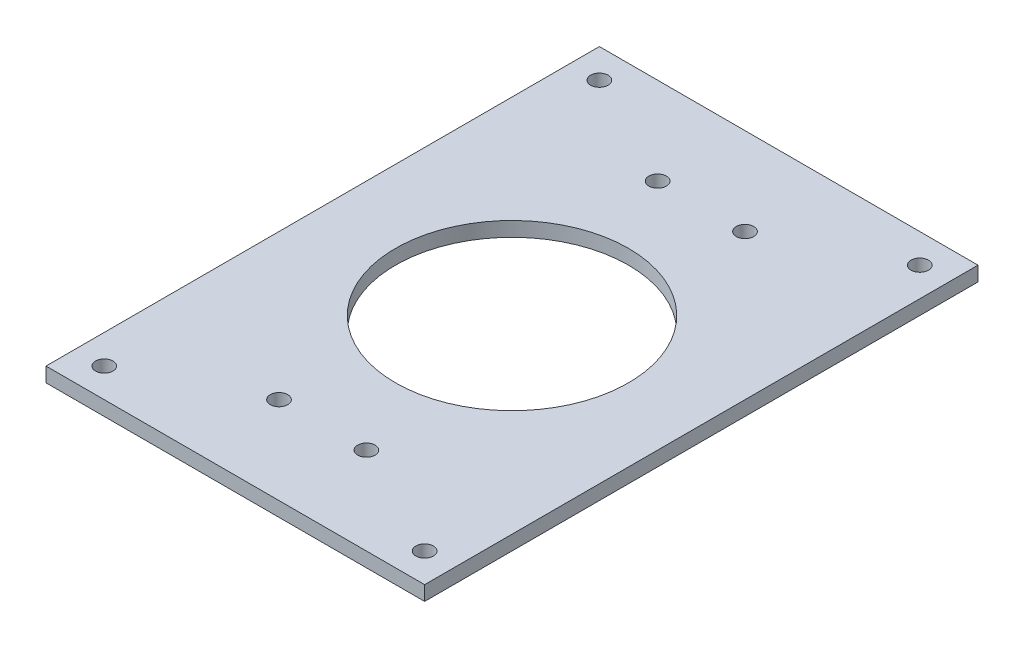
from build123d import *

# Parameters (mm, degrees)
CROQUIS1_W              = 65
CROQUIS1_H              = 95
SALIENTE_EXTRUIR1_DEPTH = 2.5
CROQUIS3_R              = 1.5
CORTAR_EXTRUIR2_DEPTH   = 58.608593109
CROQUIS4_R              = 20
CORTAR_EXTRUIR3_DEPTH   = 58.608593109


with BuildPart() as part:
    # Croquis1 → Saliente-Extruir1 (new body)
    with BuildSketch(Plane(origin=(0, 0, 0), x_dir=(1, 0, 0), z_dir=(0, 1, 0))):
        Rectangle(CROQUIS1_W, CROQUIS1_H)
    extrude(amount=SALIENTE_EXTRUIR1_DEPTH)

    # Croquis3 → Cortar-Extruir2 (cut, through all)
    with BuildSketch(Plane(origin=(0, 2.5, 0), x_dir=(1, 0, 0), z_dir=(0, 1, 0))):
        with Locations(Location((27.5, 42.5, 0), (0, 0, 270))):
            Circle(CROQUIS3_R)
        with Locations(Location((7.5, 32.5, 0), (0, 0, 270))):
            Circle(CROQUIS3_R)
        with Locations(Location((7.5, -32.5, 0), (0, 0, 90))):
            Circle(CROQUIS3_R)
        with Locations(Location((27.5, -42.5, 0), (0, 0, 90))):
            Circle(CROQUIS3_R)
        with Locations(Location((-27.5, 42.5, 0), (0, 0, 90))):
            Circle(CROQUIS3_R)
        with Locations(Location((-7.5, 32.5, 0), (0, 0, 90))):
            Circle(CROQUIS3_R)
        with Locations(Location((-27.5, -42.5, 0), (0, 0, 270))):
            Circle(CROQUIS3_R)
        with Locations(Location((-7.5, -32.5, 0), (0, 0, 270))):
            Circle(CROQUIS3_R)
    extrude(amount=-CORTAR_EXTRUIR2_DEPTH, mode=Mode.SUBTRACT)

    # Croquis4 → Cortar-Extruir3 (cut, through all)
    with BuildSketch(Plane(origin=(0, 2.5, 0), x_dir=(1, 0, 0), z_dir=(0, 1, 0))):
        with Locations(Location((0, 0, 0), (0, 0, 270))):
            Circle(CROQUIS4_R)
    extrude(amount=-CORTAR_EXTRUIR3_DEPTH, mode=Mode.SUBTRACT)


solid = part.part
